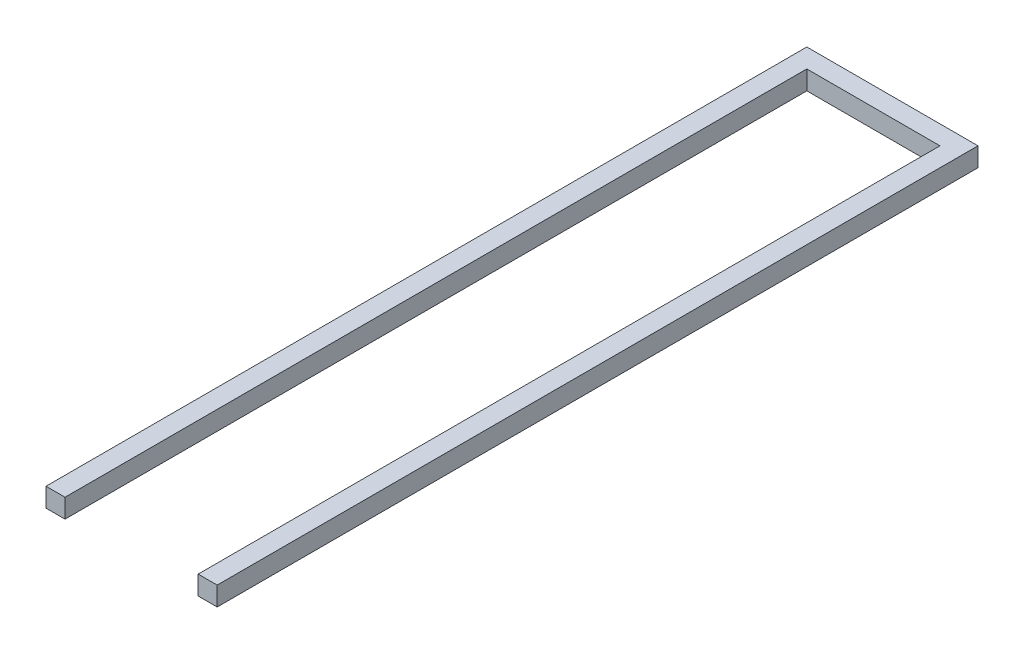
from build123d import *

# Parameters (mm, degrees)
SKETCH_1_W      = 50
SKETCH_1_H      = 50
EXTRUDE_1_DEPTH = 2000
SKETCH_2_W      = 50
SKETCH_2_H      = 50
EXTRUDE_2_DEPTH = 2000
SKETCH_3_W      = 400
SKETCH_3_H      = 50
EXTRUDE_3_DEPTH = 50
SKETCH_4_W      = 400
SKETCH_4_H      = 50
EXTRUDE_4_DEPTH = 50
SKETCH_5_W      = 400
SKETCH_5_H      = 50
EXTRUDE_5_DEPTH = 50
SKETCH_6_W      = 400
SKETCH_6_H      = 50
EXTRUDE_6_DEPTH = 50
SKETCH_7_W      = 400
SKETCH_7_H      = 50
EXTRUDE_7_DEPTH = 50


with BuildPart() as part:
    # 草图1 → 凸台-拉伸1 (new body)
    with BuildSketch(Plane.XY):
        with Locations((-200, 0)):
            Rectangle(SKETCH_1_W, SKETCH_1_H)
    extrude(amount=EXTRUDE_1_DEPTH)



with BuildPart() as body_2:
    # 草图2 → 凸台-拉伸2 (new body)
    with BuildSketch(Plane.XY):
        with Locations((200, 0)):
            Rectangle(SKETCH_2_W, SKETCH_2_H)
    extrude(amount=EXTRUDE_2_DEPTH)


with BuildPart() as part_1:
    add(part.part)

    add(body_2.part)  # 凸台-拉伸3 merges body 2
    # 草图3 → 凸台-拉伸3 (add)
    with BuildSketch(Plane.XY):
        Rectangle(SKETCH_3_W, SKETCH_3_H)
    extrude(amount=EXTRUDE_3_DEPTH)

    # 草图4 → 凸台-拉伸4 (add)
    with BuildSketch(Plane.XY):
        Rectangle(SKETCH_4_W, SKETCH_4_H)
    extrude(amount=EXTRUDE_4_DEPTH)

    # 草图5 → 凸台-拉伸5 (add)
    with BuildSketch(Plane.XY):
        Rectangle(SKETCH_5_W, SKETCH_5_H)
    extrude(amount=EXTRUDE_5_DEPTH)

    # 草图6 → 凸台-拉伸6 (add)
    with BuildSketch(Plane.XY):
        Rectangle(SKETCH_6_W, SKETCH_6_H)
    extrude(amount=EXTRUDE_6_DEPTH)

    # 草图7 → 凸台-拉伸7 (add)
    with BuildSketch(Plane.XY):
        Rectangle(SKETCH_7_W, SKETCH_7_H)
    extrude(amount=EXTRUDE_7_DEPTH)


solid = part_1.part
